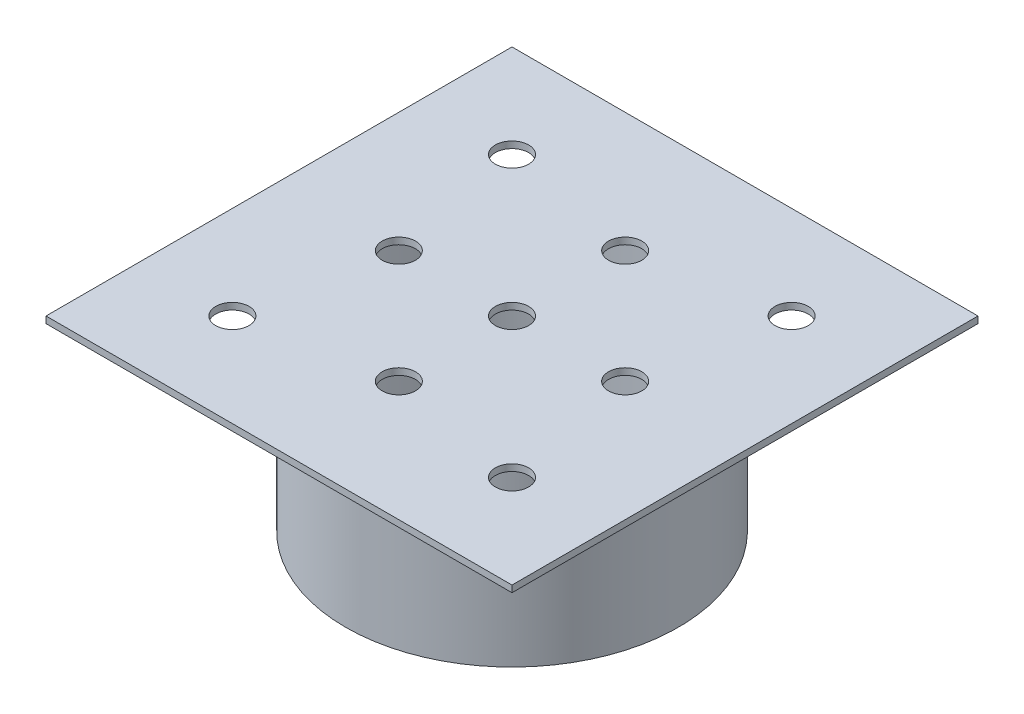
from build123d import *

# Parameters (mm, degrees)
SKETCH1_W           = 70
SKETCH1_H           = 70
BOSS_EXTRUDE1_DEPTH = 1
SKETCH2_R           = 25
SKETCH2_R_2         = 23
BOSS_EXTRUDE2_DEPTH = 27
SKETCH3_R           = 2.5
CUT_EXTRUDE1_DEPTH  = 1
SKETCH4_R           = 2.5
CUT_EXTRUDE2_DEPTH  = 1


with BuildPart() as part:
    # Sketch1 → Boss-Extrude1 (new body)
    with BuildSketch(Plane(origin=(0, 0, 0), x_dir=(1, 0, 0), z_dir=(0, 1, 0))):
        Rectangle(SKETCH1_W, SKETCH1_H)
    extrude(amount=BOSS_EXTRUDE1_DEPTH)

    # Sketch2 → Boss-Extrude2 (add)
    with BuildSketch(Plane.XZ):
        with Locations(Location((0, 0, 0), (0, 0, 90))):
            Circle(SKETCH2_R)
        with Locations(Location((0, 0, 0), (0, 0, 270))):
            Circle(SKETCH2_R_2, mode=Mode.SUBTRACT)
    extrude(amount=BOSS_EXTRUDE2_DEPTH)

    # Sketch3 → Cut-Extrude1 (cut)
    with BuildSketch(Plane(origin=(0, 1, 0), x_dir=(1, 0, 0), z_dir=(0, 1, 0))):
        with Locations(Location((0, 0, 0), (0, 0, 270))):
            Circle(SKETCH3_R)
        with Locations(Location((0, 17, 0), (0, 0, 270))):
            Circle(SKETCH3_R)
        with Locations(Location((17, 0, 0), (0, 0, 270))):
            Circle(SKETCH3_R)
        with Locations(Location((0, -17, 0), (0, 0, 270))):
            Circle(SKETCH3_R)
        with Locations(Location((-17, 0, 0), (0, 0, 270))):
            Circle(SKETCH3_R)
    extrude(amount=-CUT_EXTRUDE1_DEPTH, mode=Mode.SUBTRACT)

    # Sketch4 → Cut-Extrude2 (cut)
    with BuildSketch(Plane(origin=(0, 1, 0), x_dir=(1, 0, 0), z_dir=(0, 1, 0))):
        with Locations(Location((21, 21, 0), (0, 0, 270))):
            Circle(SKETCH4_R)
        with Locations(Location((21, -21, 0), (0, 0, 270))):
            Circle(SKETCH4_R)
        with Locations(Location((-21, 21, 0), (0, 0, 270))):
            Circle(SKETCH4_R)
        with Locations(Location((-21, -21, 0), (0, 0, 270))):
            Circle(SKETCH4_R)
    extrude(amount=-CUT_EXTRUDE2_DEPTH, mode=Mode.SUBTRACT)


solid = part.part
